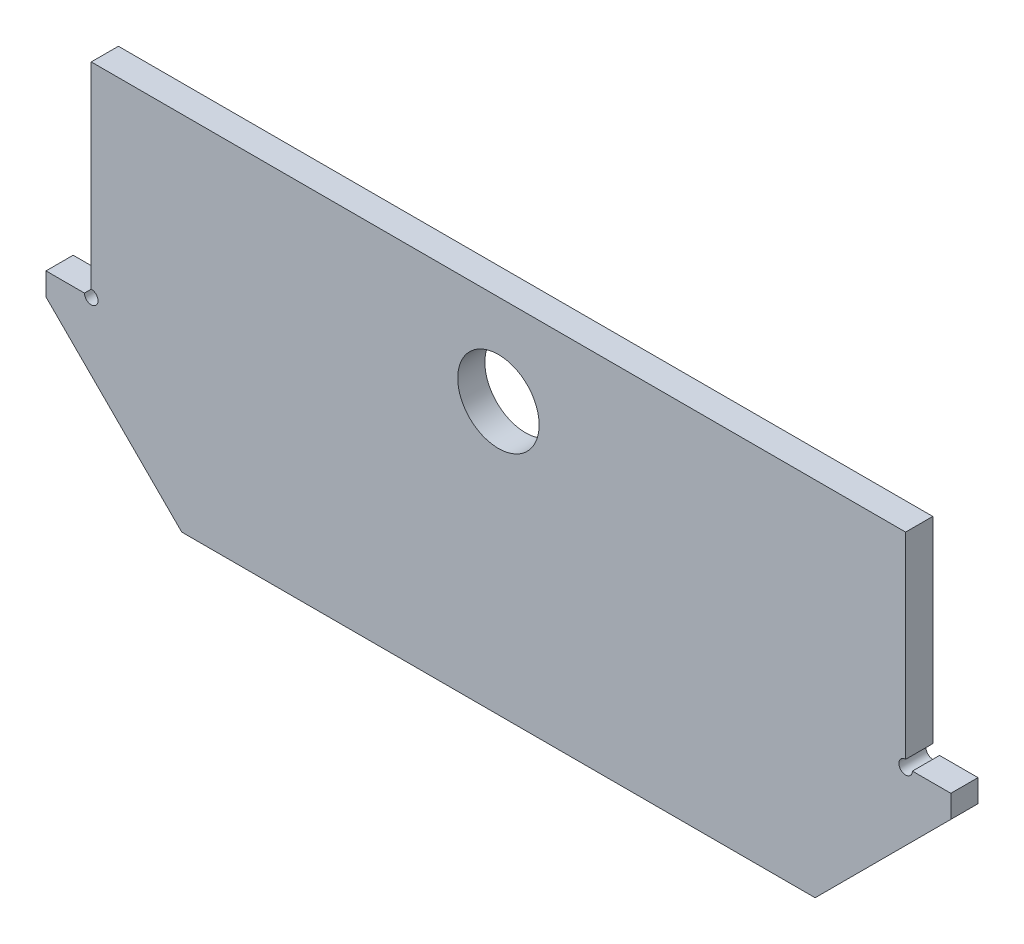
from build123d import *

# Parameters (mm, degrees)
BOSS_EXTRUDE1_DEPTH      = 3
BOSS_EXTRUDE1_DEPTH_BACK = 3
CUT_EXTRUDE1_DEPTH       = 1453.458949506
CUT_EXTRUDE1_DEPTH_BACK  = 1453.458949506
SKETCH2_R                = 9
CUT_EXTRUDE2_DEPTH       = 1453.458949506
CUT_EXTRUDE2_DEPTH_BACK  = 1453.458949506
SKETCH3_R                = 1.5


with BuildPart() as part:
    # Sketch1 → Boss-Extrude1 (new, two sides: drawn at the far end of the back side and taken through both)
    with BuildSketch(Plane.XY.offset(-BOSS_EXTRUDE1_DEPTH_BACK)):
        Polygon((-90, -1414), (-90, -1369), (90, -1369), (90, -1414), (100, -1414), (100, -1419), (70, -1449), (-70, -1449), (-100, -1419), (-100, -1414), align=None)
    extrude(amount=BOSS_EXTRUDE1_DEPTH + BOSS_EXTRUDE1_DEPTH_BACK)

    # Sketch2 → Cut-Extrude1 (cut, two sides: drawn at the far end of the back side and taken through both)
    with BuildSketch(Plane.XY.offset(3).offset(-CUT_EXTRUDE1_DEPTH_BACK)):
        with Locations((0, -1389)):
            Circle(SKETCH2_R)
    extrude(amount=CUT_EXTRUDE1_DEPTH + CUT_EXTRUDE1_DEPTH_BACK, mode=Mode.SUBTRACT)

    # Sketch3 → Cut-Extrude2 (cut, two sides: drawn at the far end of the back side and taken through both)
    with BuildSketch(Plane.XY.offset(3).offset(-CUT_EXTRUDE2_DEPTH_BACK)):
        with Locations((-90, -1414)):
            Circle(SKETCH3_R)
        with Locations((90, -1414)):
            Circle(SKETCH3_R)
    extrude(amount=CUT_EXTRUDE2_DEPTH + CUT_EXTRUDE2_DEPTH_BACK, mode=Mode.SUBTRACT)


solid = part.part
